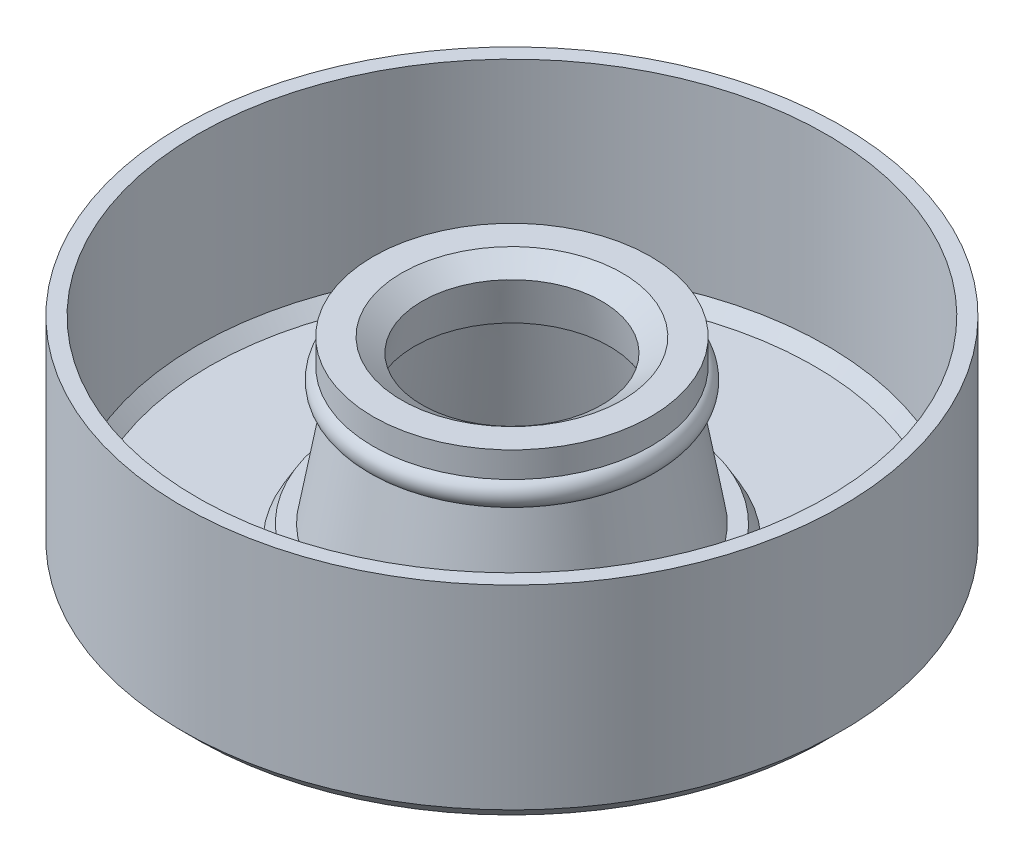
from build123d import *


with BuildPart() as part:
    # 草图1 → 旋转1 (revolve)
    with BuildSketch(Plane.XY):
        with BuildLine():
            Line((-10.1, 0.5), (-5.873607887, 0.5))
            Line((-5.873607887, 0.5), (-5.584932753, 1))
            Line((-5.584932753, 1), (-5.084932753, 1))
            Line((-5.084932753, 1), (-4.432451432, 4.700405452))
            ThreePointArc((-4.432451432, 4.700405452), (-4.867701612, 5.044870418), (-4.632451432, 5.547619048))
            Line((-4.632451432, 5.547619048), (-4.632451432, 6.404761905))
            Line((-4.632451432, 6.404761905), (-3.680070479, 6.404761905))
            Line((-3.680070479, 6.404761905), (-3, 5.928571429))
            Line((-3, 5.928571429), (-3.251895687, 4.5))
            Line((-3.251895687, 4.5), (-3.960075014, 4.5))
            Line((-3.960075014, 4.5), (-4.753546427, 0))
            Line((-4.753546427, 0), (-10.5, 0))
            Line((-10.5, 0), (-11, 0.5))
            Line((-11, 0.5), (-11, 7))
            Line((-11, 7), (-10.5, 7))
            Line((-10.5, 7), (-10.5, 0.9))
            Line((-10.5, 0.9), (-10.1, 0.5))
        make_face()
    revolve(axis=Axis((0, 5.836193369, 0), (0, -1, 0)))


solid = part.part
